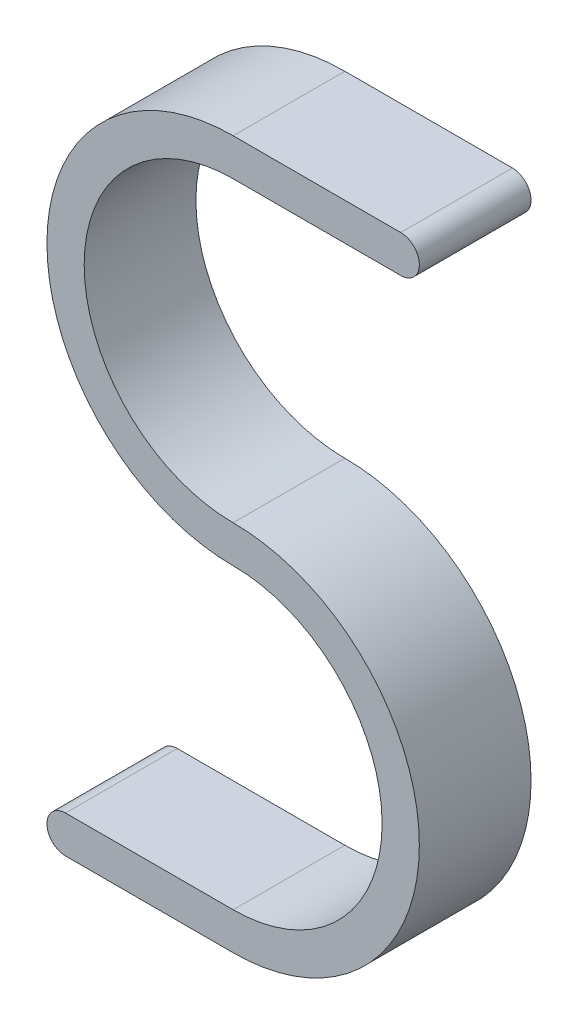
from build123d import *

# Parameters (mm, degrees)
BOSS_EXTRUDE1_DEPTH = 15


with BuildPart() as part:
    # Sketch1 → Boss-Extrude1 (new body)
    with BuildSketch(Plane.XY):
        with BuildLine():
            Line((0, 2.5), (-22.5, 2.5))
            ThreePointArc((-22.5, 2.5), (-47.5, -22.5), (-22.5, -47.5))
            ThreePointArc((-22.5, -47.5), (-2.5, -67.5), (-22.5, -87.5))
            Line((-22.5, -87.5), (-45, -87.5))
            ThreePointArc((-45, -87.5), (-47.5, -90), (-45, -92.5))
            Line((-45, -92.5), (-22.5, -92.5))
            ThreePointArc((-22.5, -92.5), (2.5, -67.5), (-22.5, -42.5))
            ThreePointArc((-22.5, -42.5), (-42.5, -22.5), (-22.5, -2.5))
            Line((-22.5, -2.5), (0, -2.5))
            ThreePointArc((0, -2.5), (2.5, 0), (0, 2.5))
        make_face()
    extrude(amount=BOSS_EXTRUDE1_DEPTH)


solid = part.part
